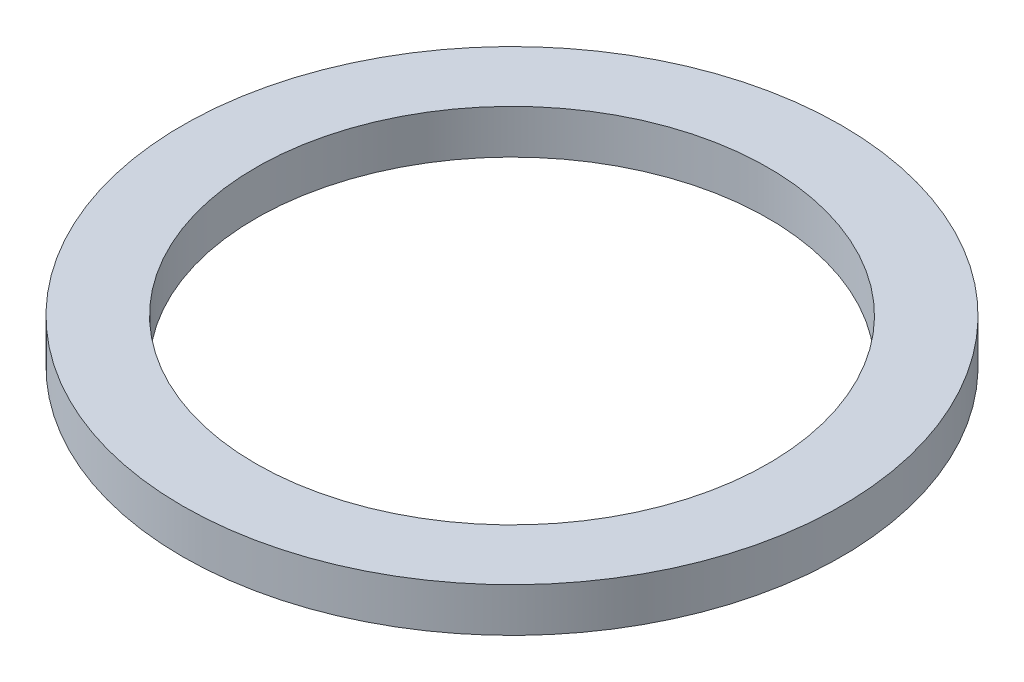
from build123d import *

# Parameters (mm, degrees)
SKETCH2_R           = 22.5
SKETCH2_R_2         = 17.5
BOSS_EXTRUDE1_DEPTH = 3


with BuildPart() as part:
    # Sketch2 → Boss-Extrude1 (new body)
    with BuildSketch(Plane(origin=(0, 0, 0), x_dir=(1, 0, 0), z_dir=(0, 1, 0))):
        with Locations(Location((0, 0, 0), (0, 0, 270))):
            Circle(SKETCH2_R)
        with Locations(Location((0, 0, 0), (0, 0, 270))):
            Circle(SKETCH2_R_2, mode=Mode.SUBTRACT)
    extrude(amount=BOSS_EXTRUDE1_DEPTH)


solid = part.part
